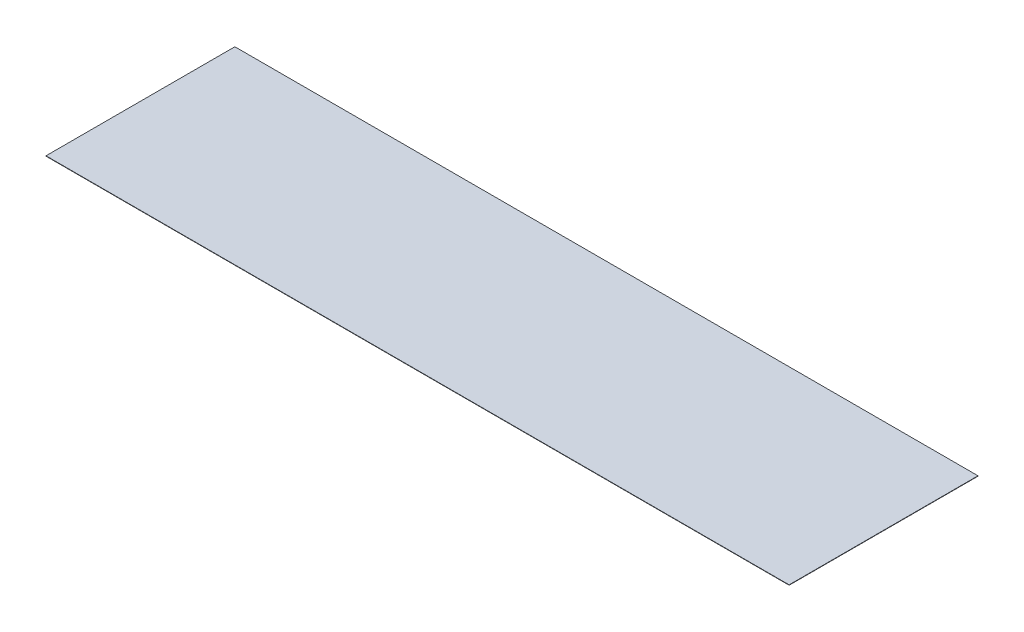
from build123d import *

# Parameters (mm, degrees)
SKETCH1_W           = 325
SKETCH1_H           = 82.6
BOSS_EXTRUDE1_DEPTH = 0.16


with BuildPart() as part:
    # Sketch1 → Boss-Extrude1 (new body)
    with BuildSketch(Plane(origin=(0, 0, 0), x_dir=(1, 0, 0), z_dir=(0, 1, 0))):
        Rectangle(SKETCH1_W, SKETCH1_H)
    extrude(amount=BOSS_EXTRUDE1_DEPTH)


solid = part.part
